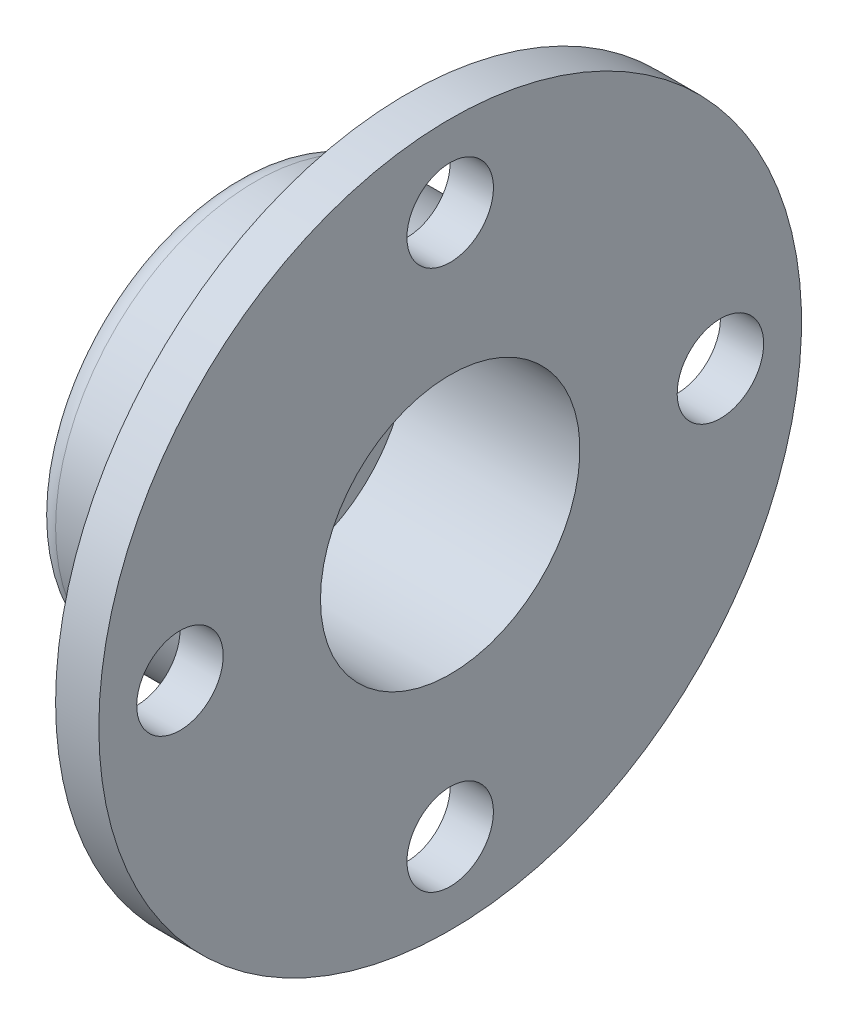
from build123d import *

# Parameters (mm, degrees)
SKETCH5_R          = 25.4
CUT_EXTRUDE1_DEPTH = 310.07425534
CIRPATTERN1_COUNT  = 4
FILLET1_R          = 12.7


with BuildPart() as part:
    # Sketch1 → Revolve6 (revolve)
    with BuildSketch(Plane(origin=(0, 0, 0), x_dir=(1, 0, 0), z_dir=(0, 1, 0)), mode=Mode.PRIVATE) as revolve6_sk:
        Polygon((0, 50.8), (0, 117.502925505), (101.6, 117.502925505), (101.6, 206.402925505), (127, 206.402925505), (127, 76.2), (25.4, 76.2), (25.4, 50.8), align=None)
    revolve(revolve6_sk.sketch.rotate(Axis((-155.979583507, 0, 0), (1, 0, 0)), 180), axis=Axis((-155.979583507, 0, 0), (1, 0, 0)))

    # Sketch5 → Cut-Extrude1 (cut, through all)
    with BuildSketch(Plane.ZY.offset(-101.6)):
        with Locations((0, 158.75)):
            Circle(SKETCH5_R)
    cut_extrude1 = extrude(amount=-CUT_EXTRUDE1_DEPTH, mode=Mode.SUBTRACT)

    # CirPattern1: Cut-Extrude1 ×4 about axis
    cirpattern1_axis = Axis((0, 0, 0), (1, 0, 0))
    for i in range(1, CIRPATTERN1_COUNT):
        add(cut_extrude1.rotate(cirpattern1_axis, i * 360 / CIRPATTERN1_COUNT), mode=Mode.SUBTRACT)

    # Fillet1
    fillet1_edges = [part.edges().sort_by_distance(p)[0] for p in [
        (0, 0, -117.502925505),
        (101.6, 0, -117.502925505),
    ]]
    fillet(fillet1_edges, radius=FILLET1_R)


solid = part.part
